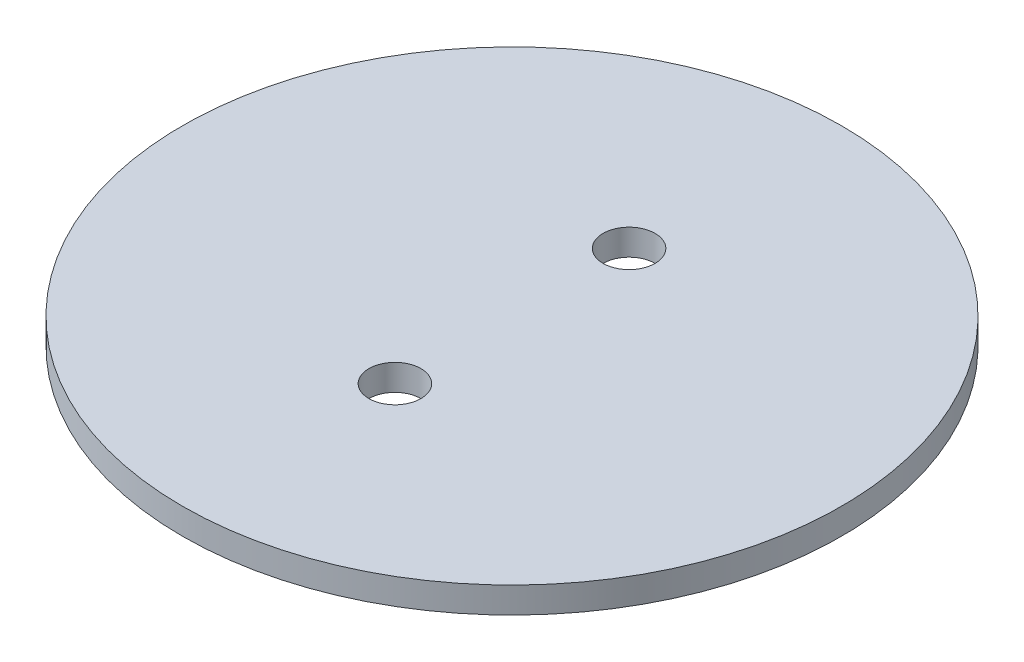
from build123d import *

# Parameters (mm, degrees)
SKETCH1_R           = 38
SKETCH1_R_2         = 3
BOSS_EXTRUDE1_DEPTH = 3


with BuildPart() as part:
    # Sketch1 → Boss-Extrude1 (new body)
    with BuildSketch(Plane(origin=(0, 0, 0), x_dir=(1, 0, 0), z_dir=(0, 1, 0))):
        with Locations(Location((0, 0, 0), (0, 0, 270))):
            Circle(SKETCH1_R)
        with Locations(Location((0, 13.5, 0), (0, 0, 270))):
            Circle(SKETCH1_R_2, mode=Mode.SUBTRACT)
        with Locations(Location((0, -13.5, 0), (0, 0, 270))):
            Circle(SKETCH1_R_2, mode=Mode.SUBTRACT)
    extrude(amount=-BOSS_EXTRUDE1_DEPTH)


solid = part.part
